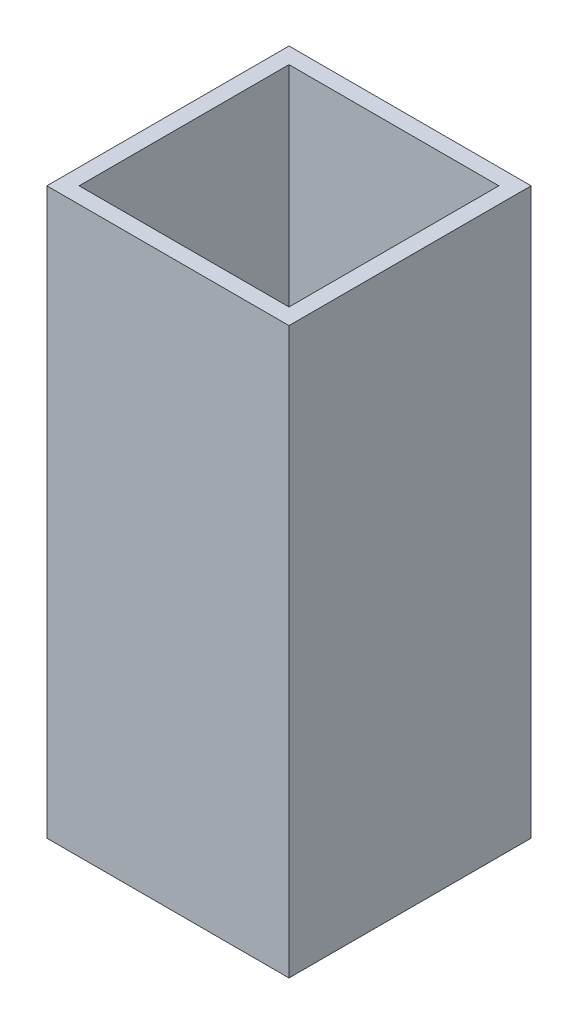
from build123d import *

# Parameters (mm, degrees)
SKETCH1_W           = 30
SKETCH1_H           = 30
SKETCH1_W_2         = 26
SKETCH1_H_2         = 26
BOSS_EXTRUDE1_DEPTH = 70


with BuildPart() as part:
    # Sketch1 → Boss-Extrude1 (new body)
    with BuildSketch(Plane(origin=(0, 0, 0), x_dir=(1, 0, 0), z_dir=(0, 1, 0))):
        Rectangle(SKETCH1_W, SKETCH1_H)
        Rectangle(SKETCH1_W_2, SKETCH1_H_2, mode=Mode.SUBTRACT)
    extrude(amount=BOSS_EXTRUDE1_DEPTH)


solid = part.part
